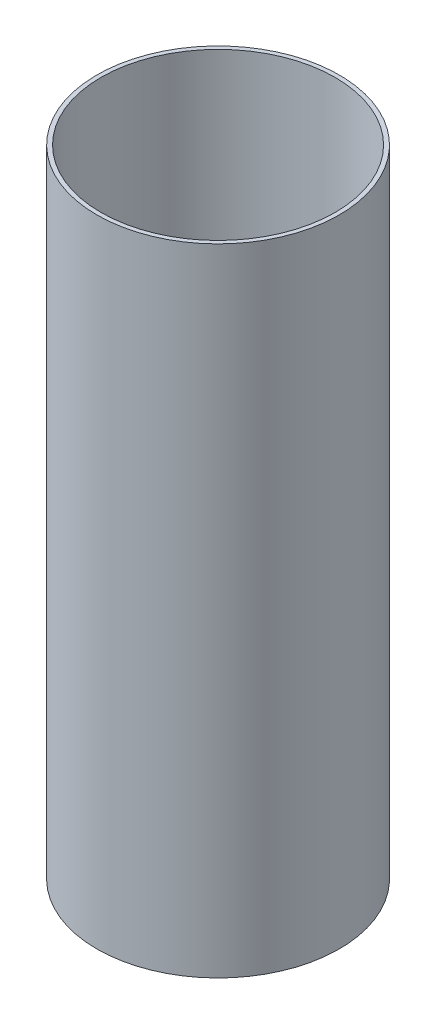
from build123d import *

# Parameters (mm, degrees)
SKETCH1_R           = 92.075
SKETCH1_R_2         = 88.9
BOSS_EXTRUDE1_DEPTH = 241.427


with BuildPart() as part:
    # Sketch1 → Boss-Extrude1 (new, symmetric)
    with BuildSketch(Plane(origin=(0, 0, 0), x_dir=(1, 0, 0), z_dir=(0, 1, 0))):
        with Locations(Location((0, 0, 0), (0, 0, 270))):
            Circle(SKETCH1_R)
        with Locations(Location((0, 0, 0), (0, 0, 270))):
            Circle(SKETCH1_R_2, mode=Mode.SUBTRACT)
    extrude(amount=BOSS_EXTRUDE1_DEPTH, both=True)


solid = part.part
